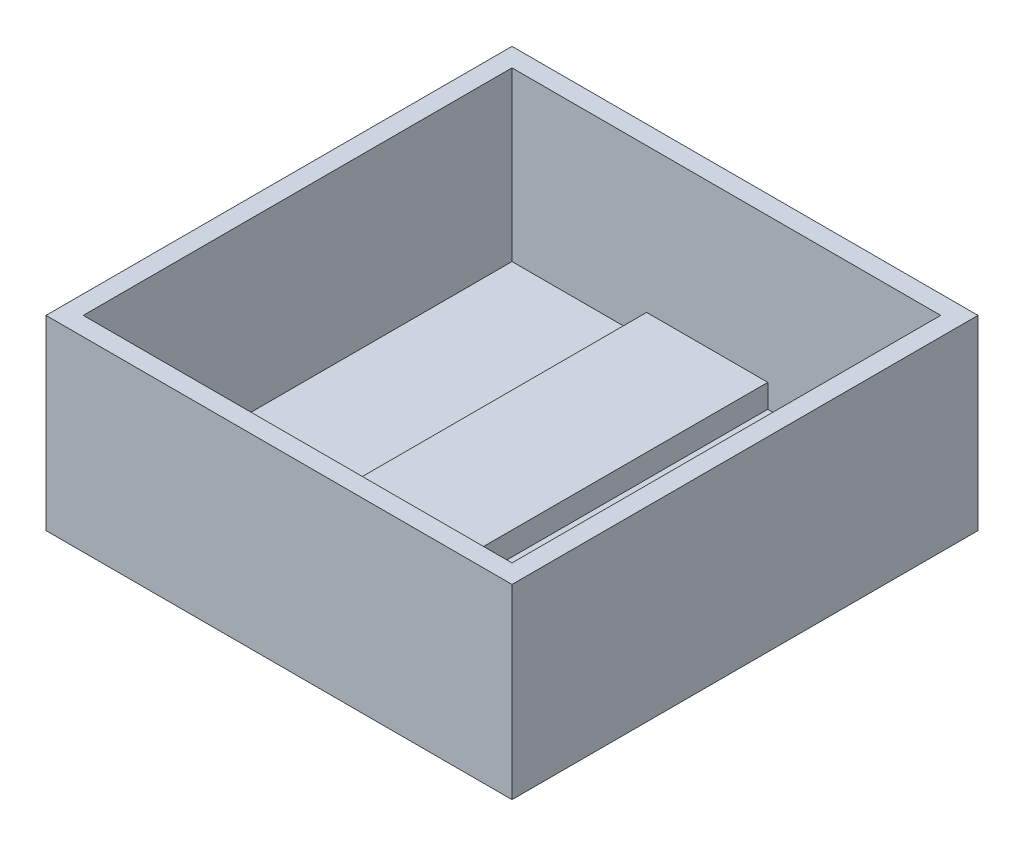
from build123d import *

# Parameters (mm, degrees)
SKETCH1_W           = 100
SKETCH1_H           = 100
BOSS_EXTRUDE1_DEPTH = 40
SKETCH2_W           = 92
SKETCH2_H           = 92
CUT_EXTRUDE1_DEPTH  = 36
SKETCH3_W           = 26
SKETCH3_H           = 70
BOSS_EXTRUDE2_DEPTH = 5


with BuildPart() as part:
    # Sketch1 → Boss-Extrude1 (new body)
    with BuildSketch(Plane(origin=(0, 0, 0), x_dir=(1, 0, 0), z_dir=(0, 1, 0))):
        with Locations((-0.571222942, 10.082692781)):
            Rectangle(SKETCH1_W, SKETCH1_H)
    extrude(amount=BOSS_EXTRUDE1_DEPTH)

    # Sketch2 → Cut-Extrude1 (cut)
    with BuildSketch(Plane(origin=(0, 40, 0), x_dir=(1, 0, 0), z_dir=(0, 1, 0))):
        with Locations((-0.571222942, 10.082692781)):
            Rectangle(SKETCH2_W, SKETCH2_H)
    extrude(amount=-CUT_EXTRUDE1_DEPTH, mode=Mode.SUBTRACT)

    # Sketch3 → Boss-Extrude2 (add)
    with BuildSketch(Plane(origin=(0, 4, 0), x_dir=(1, 0, 0), z_dir=(0, 1, 0))):
        with Locations((-4.678043983, 25.082692781)):
            Rectangle(SKETCH3_W, SKETCH3_H)
    extrude(amount=BOSS_EXTRUDE2_DEPTH)


solid = part.part
